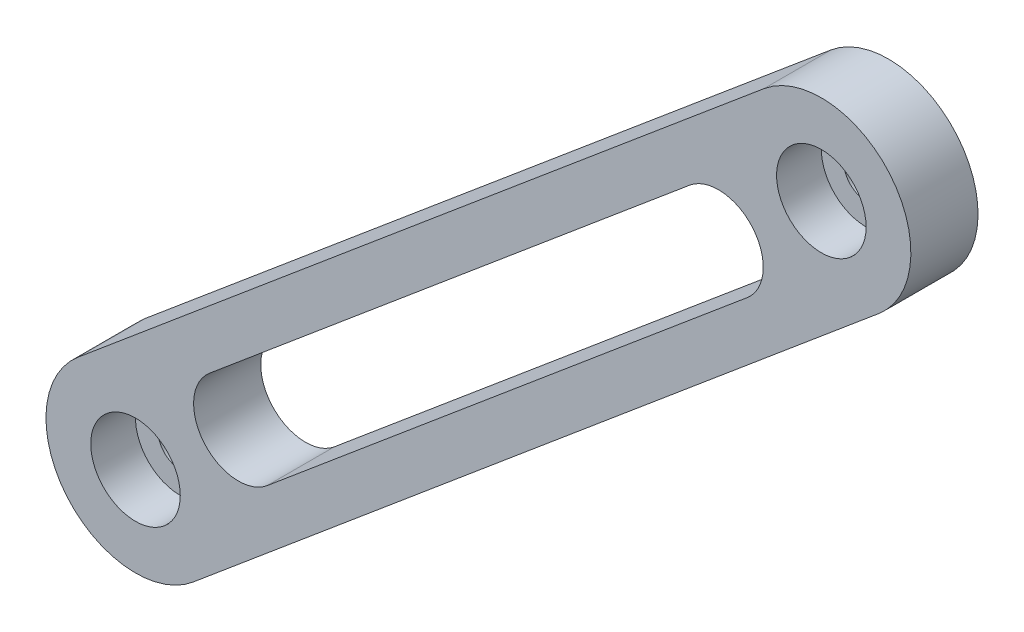
from build123d import *

# Parameters (mm, degrees)
SKETCH1_R           = 6.35
BOSS_EXTRUDE1_DEPTH = 19.05
SKETCH2_R           = 12.7
CUT_EXTRUDE1_DEPTH  = 12.7


with BuildPart() as part:
    # Sketch1 → Boss-Extrude1 (new body)
    with BuildSketch(Plane.XY):
        with BuildLine():
            Line((460.355875575, 412.642954232), (265.780587023, 249.374901371))
            ThreePointArc((265.780587023, 249.374901371), (262.649862661, 213.590568174), (298.434195706, 210.459842076))
            Line((298.434195706, 210.459842076), (493.009486147, 373.727896521))
            ThreePointArc((493.009486147, 373.727896521), (496.140209716, 409.512230662), (460.355875575, 412.642954232))
        make_face()
        with Locations(Location((282.107391364, 229.917371724, 0), (0, 0, 180))):
            Circle(SKETCH1_R, mode=Mode.SUBTRACT)
        with Locations(Location((476.682680861, 393.185425376, 0), (0, 0, 180))):
            Circle(SKETCH1_R, mode=Mode.SUBTRACT)
        with BuildLine():
            Line((455.659790221, 358.96645302), (319.457088235, 244.678816018))
            ThreePointArc((319.457088235, 244.678816018), (301.564921164, 246.244177802), (303.130282949, 264.136344873))
            Line((303.130282949, 264.136344873), (439.332984935, 378.423981875))
            ThreePointArc((439.332984935, 378.423981875), (457.225152006, 376.85862009), (455.659790221, 358.96645302))
        make_face(mode=Mode.SUBTRACT)
    extrude(amount=BOSS_EXTRUDE1_DEPTH)

    # Sketch2 → Cut-Extrude1 (cut)
    with BuildSketch(Plane.XY.offset(19.05)):
        with Locations((282.107391364, 229.917371724)):
            Circle(SKETCH2_R)
        with Locations((476.682680861, 393.185425376)):
            Circle(SKETCH2_R)
    extrude(amount=-CUT_EXTRUDE1_DEPTH, mode=Mode.SUBTRACT)


solid = part.part
